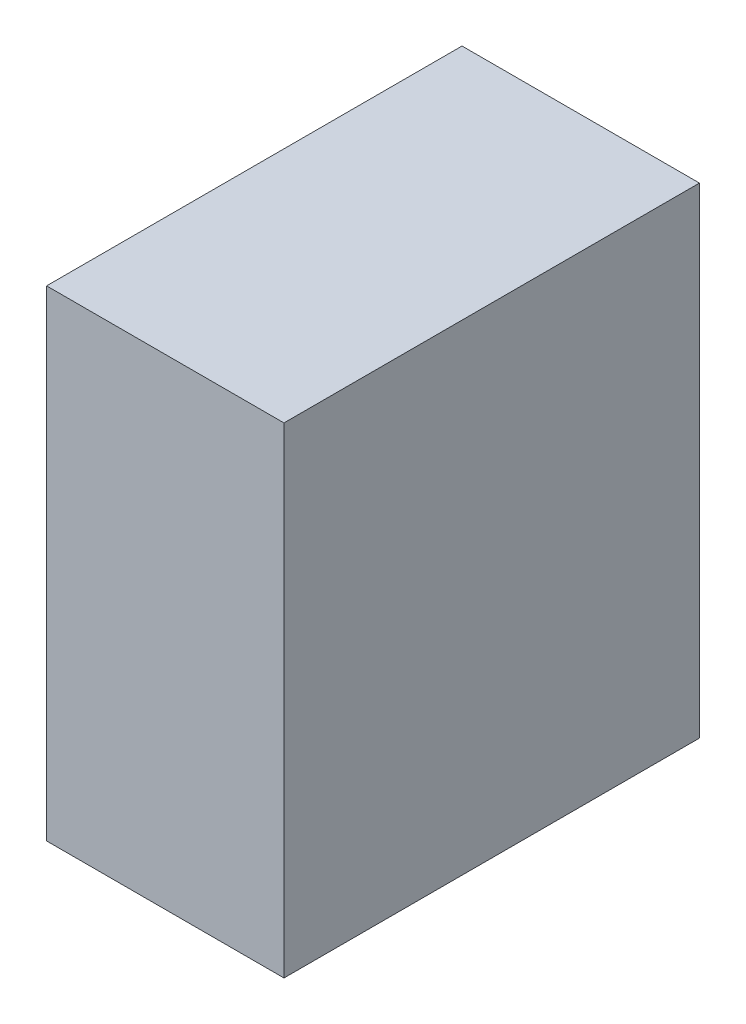
from build123d import *

# Parameters (mm, degrees)
SKETCH1_W           = 20.32
SKETCH1_H           = 35.56
BOSS_EXTRUDE1_DEPTH = 41.148


with BuildPart() as part:
    # Sketch1 → Boss-Extrude1 (new body)
    with BuildSketch(Plane(origin=(0, 0, 0), x_dir=(1, 0, 0), z_dir=(0, 1, 0))):
        with Locations((10.16, 17.78)):
            Rectangle(SKETCH1_W, SKETCH1_H)
    extrude(amount=BOSS_EXTRUDE1_DEPTH)


solid = part.part
